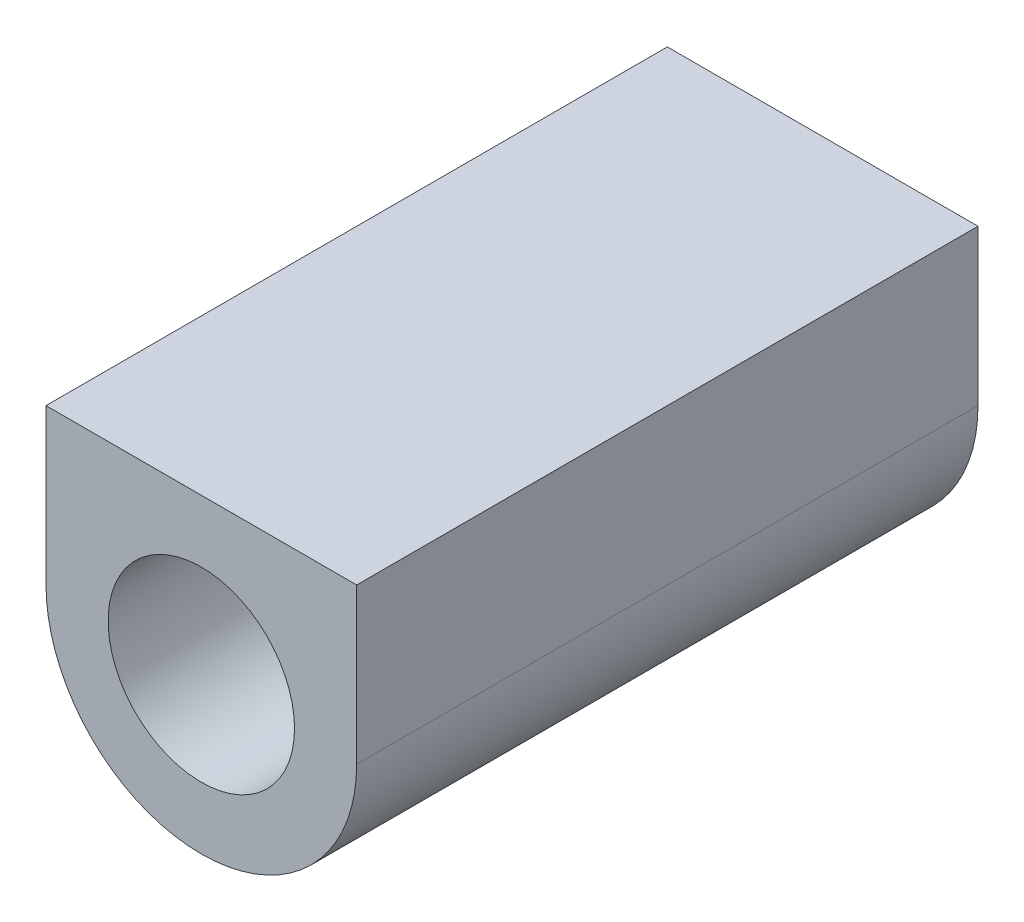
from build123d import *

# Parameters (mm, degrees)
ESQUISSE1_W             = 5
ESQUISSE1_H             = 5
BOSS_EXTRU_1_DEPTH      = 10
ESQUISSE2_R             = 1.5
ENL_V_MAT_EXTRU_1_DEPTH = 13.247448714


with BuildPart() as part:
    # Esquisse1 → Boss.-Extru.1 (new body)
    with BuildSketch(Plane.XY):
        with Locations((2.5, 2.5)):
            Rectangle(ESQUISSE1_W, ESQUISSE1_H)
    extrude(amount=BOSS_EXTRU_1_DEPTH)

    # Esquisse2 → Enlèv. mat.-Extru.1 (cut, through all)
    with BuildSketch(Plane.XY.offset(10)):
        with Locations((2.5, 2.5)):
            Circle(ESQUISSE2_R)
        with BuildLine():
            ThreePointArc((5, 2.5), (4.267766953, 0.732233047), (2.5, 0))
            Line((2.5, 0), (5, 0))
            Line((5, 0), (5, 2.5))
        make_face()
        with BuildLine():
            ThreePointArc((2.5, 0), (0.732233047, 0.732233047), (0, 2.5))
            Line((0, 2.5), (0, 0))
            Line((0, 0), (2.5, 0))
        make_face()
    extrude(amount=-ENL_V_MAT_EXTRU_1_DEPTH, mode=Mode.SUBTRACT)


solid = part.part
